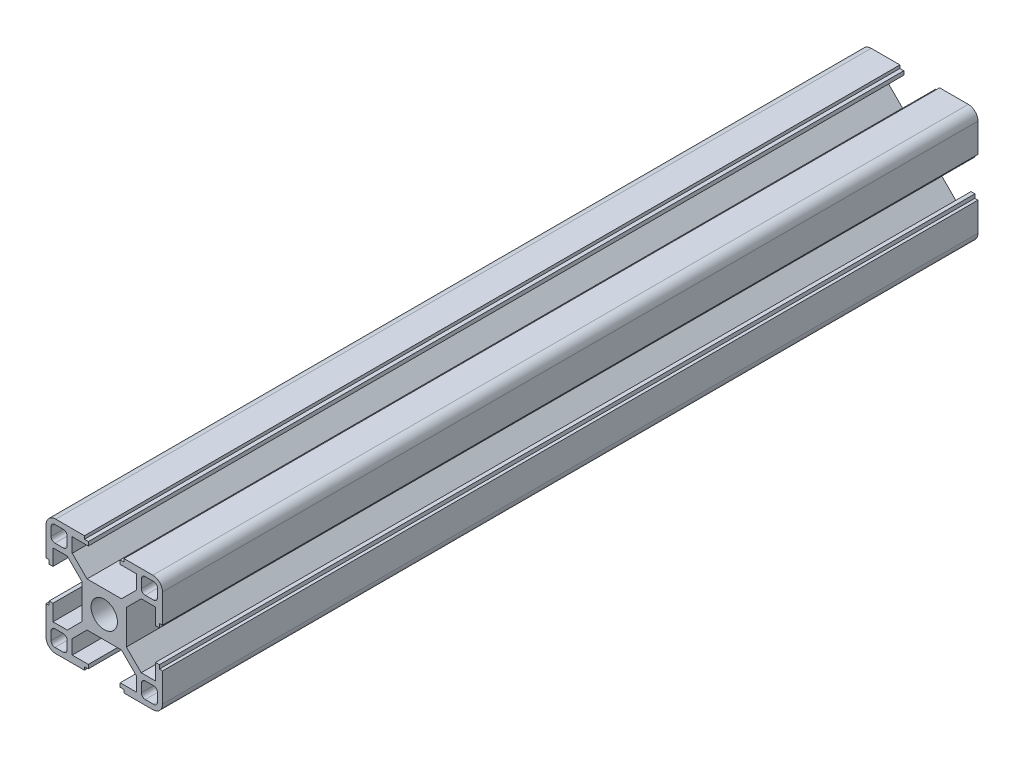
from build123d import *

# Parameters (mm, degrees)
SKETCH1_R      = 3.4
EXTRUDE1_DEPTH = 210
EXTRUDE2_DEPTH = 212.068709192


with BuildPart() as part:
    # Sketch1 → Extrude1 (new body)
    with BuildSketch(Plane.XY):
        with BuildLine():
            Line((-5.1, 14.2), (-5.1, 15))
            Line((-5.1, 15), (-12.5, 15))
            ThreePointArc((-12.5, 15), (-14.267766953, 14.267766953), (-15, 12.5))
            Line((-15, 12.5), (-15, 5.1))
            Line((-15, 5.1), (-14.2, 5.1))
            Line((-14.2, 5.1), (-14.2, 4.1))
            Line((-14.2, 4.1), (-13.2, 4.1))
            Line((-13.2, 4.1), (-13.2, 8.25))
            Line((-13.2, 8.25), (-9.522792206, 8.25))
            Line((-9.522792206, 8.25), (-5.7, 4.427207794))
            Line((-5.7, 4.427207794), (-5.7, -4.427207794))
            Line((-5.7, -4.427207794), (-9.522792206, -8.25))
            Line((-9.522792206, -8.25), (-13.2, -8.25))
            Line((-13.2, -8.25), (-13.2, -4.1))
            Line((-13.2, -4.1), (-14.2, -4.1))
            Line((-14.2, -4.1), (-14.2, -5.1))
            Line((-14.2, -5.1), (-15, -5.1))
            Line((-15, -5.1), (-15, -12.5))
            ThreePointArc((-15, -12.5), (-14.267766953, -14.267766953), (-12.5, -15))
            Line((-12.5, -15), (-5.1, -15))
            Line((-5.1, -15), (-5.1, -14.2))
            Line((-5.1, -14.2), (-4.1, -14.2))
            Line((-4.1, -14.2), (-4.1, -13.2))
            Line((-4.1, -13.2), (-8.25, -13.2))
            Line((-8.25, -13.2), (-8.25, -9.522792206))
            Line((-8.25, -9.522792206), (-4.427207794, -5.7))
            Line((-4.427207794, -5.7), (4.427207794, -5.7))
            Line((4.427207794, -5.7), (8.25, -9.522792206))
            Line((8.25, -9.522792206), (8.25, -13.2))
            Line((8.25, -13.2), (4.1, -13.2))
            Line((4.1, -13.2), (4.1, -14.2))
            Line((4.1, -14.2), (5.1, -14.2))
            Line((5.1, -14.2), (5.1, -15))
            Line((5.1, -15), (12.5, -15))
            ThreePointArc((12.5, -15), (14.267766953, -14.267766953), (15, -12.5))
            Line((15, -12.5), (15, -5.1))
            Line((15, -5.1), (14.2, -5.1))
            Line((14.2, -5.1), (14.2, -4.1))
            Line((14.2, -4.1), (13.2, -4.1))
            Line((13.2, -4.1), (13.2, -8.25))
            Line((13.2, -8.25), (9.522792206, -8.25))
            Line((9.522792206, -8.25), (5.7, -4.427207794))
            Line((5.7, -4.427207794), (5.7, 4.427207794))
            Line((5.7, 4.427207794), (9.522792206, 8.25))
            Line((9.522792206, 8.25), (13.2, 8.25))
            Line((13.2, 8.25), (13.2, 4.1))
            Line((13.2, 4.1), (14.2, 4.1))
            Line((14.2, 4.1), (14.2, 5.1))
            Line((14.2, 5.1), (15, 5.1))
            Line((15, 5.1), (15, 12.5))
            ThreePointArc((15, 12.5), (14.267766953, 14.267766953), (12.5, 15))
            Line((12.5, 15), (5.1, 15))
            Line((5.1, 15), (5.1, 14.2))
            Line((5.1, 14.2), (4.1, 14.2))
            Line((4.1, 14.2), (4.1, 13.2))
            Line((4.1, 13.2), (8.25, 13.2))
            Line((8.25, 13.2), (8.25, 9.522792206))
            Line((8.25, 9.522792206), (4.427207794, 5.7))
            Line((4.427207794, 5.7), (-4.427207794, 5.7))
            Line((-4.427207794, 5.7), (-8.25, 9.522792206))
            Line((-8.25, 9.522792206), (-8.25, 13.2))
            Line((-8.25, 13.2), (-4.1, 13.2))
            Line((-4.1, 13.2), (-4.1, 14.2))
            Line((-4.1, 14.2), (-5.1, 14.2))
        make_face()
        Circle(SKETCH1_R, mode=Mode.SUBTRACT)
    extrude(amount=EXTRUDE1_DEPTH)

    # Sketch2 → Extrude2 (cut, through all)
    with BuildSketch(Plane.XY.offset(210)):
        with BuildLine():
            Line((13.7, 12.7), (13.7, 10.55))
            ThreePointArc((13.7, 10.55), (13.407106781, 9.842893219), (12.7, 9.55))
            Line((12.7, 9.55), (10.55, 9.55))
            ThreePointArc((10.55, 9.55), (9.842893219, 9.842893219), (9.55, 10.55))
            Line((9.55, 10.55), (9.55, 12.7))
            ThreePointArc((9.55, 12.7), (9.842893219, 13.407106781), (10.55, 13.7))
            Line((10.55, 13.7), (12.7, 13.7))
            ThreePointArc((12.7, 13.7), (13.407106781, 13.407106781), (13.7, 12.7))
        make_face()
        with BuildLine():
            Line((-12.7, 13.7), (-10.55, 13.7))
            ThreePointArc((-10.55, 13.7), (-9.842893219, 13.407106781), (-9.55, 12.7))
            Line((-9.55, 12.7), (-9.55, 10.55))
            ThreePointArc((-9.55, 10.55), (-9.842893219, 9.842893219), (-10.55, 9.55))
            Line((-10.55, 9.55), (-12.7, 9.55))
            ThreePointArc((-12.7, 9.55), (-13.407106781, 9.842893219), (-13.7, 10.55))
            Line((-13.7, 10.55), (-13.7, 12.7))
            ThreePointArc((-13.7, 12.7), (-13.407106781, 13.407106781), (-12.7, 13.7))
        make_face()
        with BuildLine():
            Line((12.7, -13.7), (10.55, -13.7))
            ThreePointArc((10.55, -13.7), (9.842893219, -13.407106781), (9.55, -12.7))
            Line((9.55, -12.7), (9.55, -10.55))
            ThreePointArc((9.55, -10.55), (9.842893219, -9.842893219), (10.55, -9.55))
            Line((10.55, -9.55), (12.7, -9.55))
            ThreePointArc((12.7, -9.55), (13.407106781, -9.842893219), (13.7, -10.55))
            Line((13.7, -10.55), (13.7, -12.7))
            ThreePointArc((13.7, -12.7), (13.407106781, -13.407106781), (12.7, -13.7))
        make_face()
        with BuildLine():
            Line((-13.7, -12.7), (-13.7, -10.55))
            ThreePointArc((-13.7, -10.55), (-13.407106781, -9.842893219), (-12.7, -9.55))
            Line((-12.7, -9.55), (-10.55, -9.55))
            ThreePointArc((-10.55, -9.55), (-9.842893219, -9.842893219), (-9.55, -10.55))
            Line((-9.55, -10.55), (-9.55, -12.7))
            ThreePointArc((-9.55, -12.7), (-9.842893219, -13.407106781), (-10.55, -13.7))
            Line((-10.55, -13.7), (-12.7, -13.7))
            ThreePointArc((-12.7, -13.7), (-13.407106781, -13.407106781), (-13.7, -12.7))
        make_face()
    extrude(amount=-EXTRUDE2_DEPTH, mode=Mode.SUBTRACT)


solid = part.part
